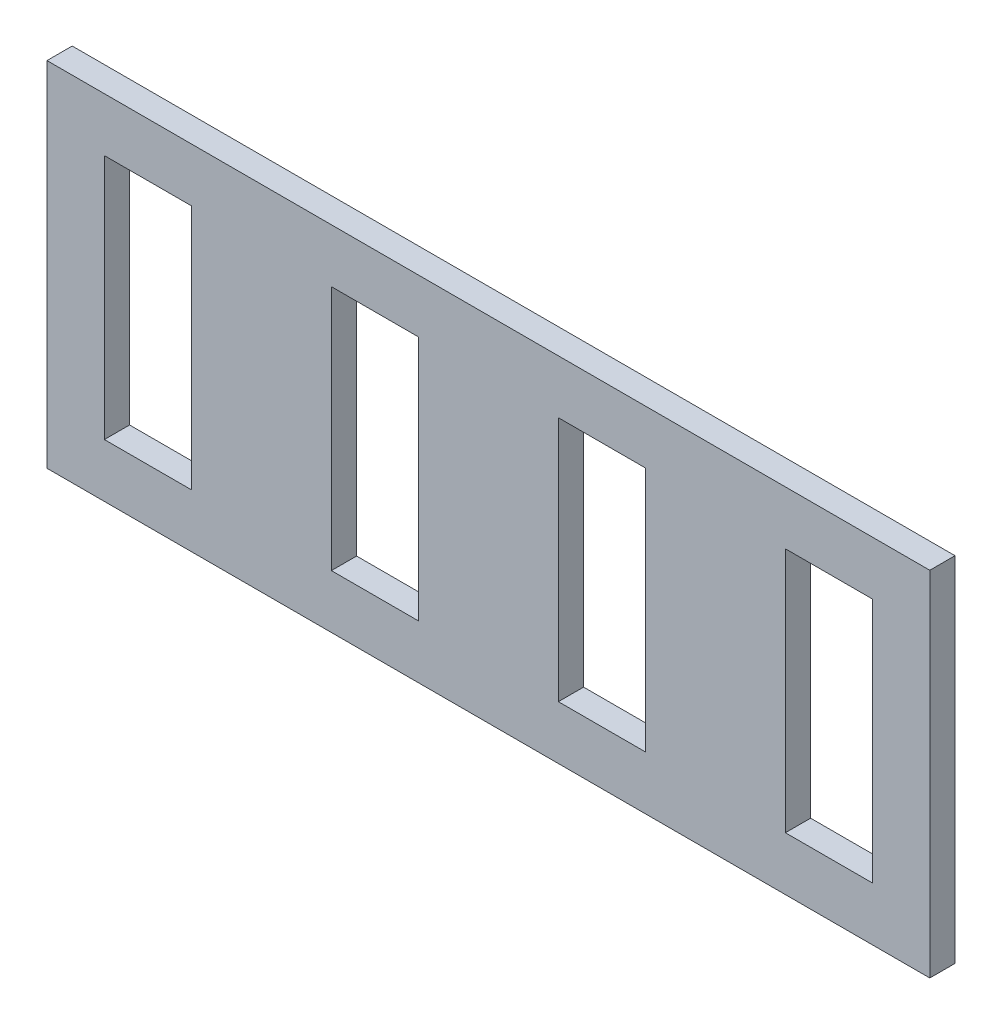
from build123d import *

# Parameters (mm, degrees)
SKETCH1_W           = 700
SKETCH1_H           = 280
SKETCH1_W_2         = 69
SKETCH1_H_2         = 195
BOSS_EXTRUDE1_DEPTH = 20


with BuildPart() as part:
    # Sketch1 → Boss-Extrude1 (new body)
    with BuildSketch(Plane.XY):
        with Locations((-105, 0)):
            Rectangle(SKETCH1_W, SKETCH1_H)
        with Locations((-195, 0)):
            Rectangle(SKETCH1_W_2, SKETCH1_H_2, mode=Mode.SUBTRACT)
        with Locations((-375, 0)):
            Rectangle(SKETCH1_W_2, SKETCH1_H_2, mode=Mode.SUBTRACT)
        with Locations((-15, 0)):
            Rectangle(SKETCH1_W_2, SKETCH1_H_2, mode=Mode.SUBTRACT)
        with Locations((165, 0)):
            Rectangle(SKETCH1_W_2, SKETCH1_H_2, mode=Mode.SUBTRACT)
    extrude(amount=BOSS_EXTRUDE1_DEPTH)


solid = part.part
